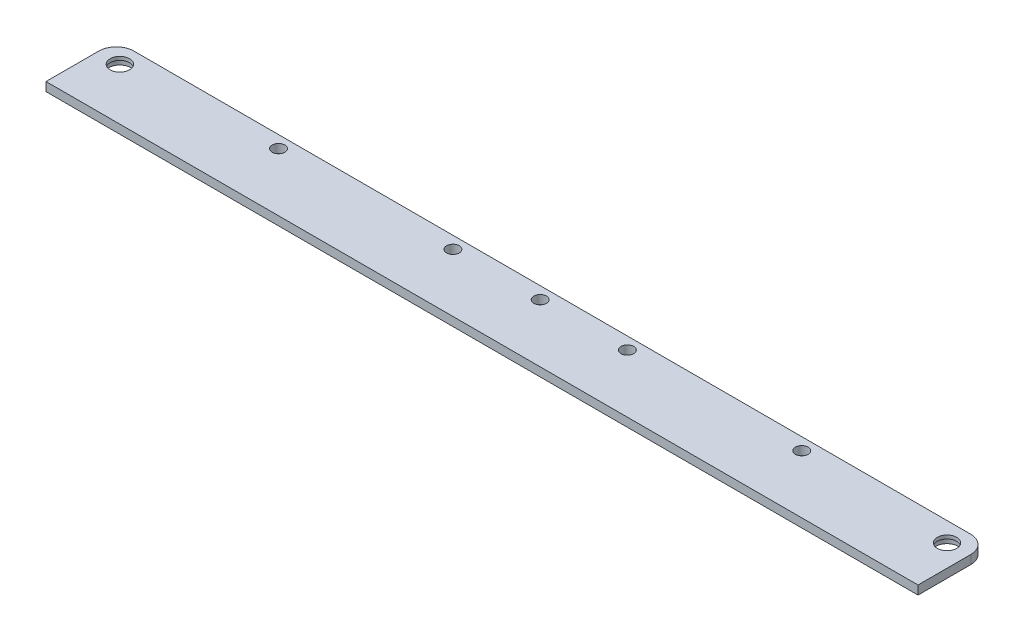
from build123d import *

# Parameters (mm, degrees)
SKETCH1_W           = 496
SKETCH1_H           = 40
SKETCH1_R           = 5.5
SKETCH1_R_2         = 3.6
BOSS_EXTRUDE1_DEPTH = 5
SKETCH2_R           = 6.5
CUT_EXTRUDE1_DEPTH  = 3
FILLET1_R           = 10


with BuildPart() as part:
    # Sketch1 → Boss-Extrude1 (new body)
    with BuildSketch(Plane(origin=(0, 0, 0), x_dir=(1, 0, 0), z_dir=(0, 1, 0))):
        with Locations((-144.299026304, 43.778006447)):
            Rectangle(SKETCH1_W, SKETCH1_H)
        with Locations(Location((-379.799026304, 53.278006447, 0), (0, 0, 270))):
            Circle(SKETCH1_R, mode=Mode.SUBTRACT)
        with Locations(Location((91.200973696, 52.778006447, 0), (0, 0, 270))):
            Circle(SKETCH1_R, mode=Mode.SUBTRACT)
        with Locations(Location((-293.099026304, 56.844673113, 0), (0, 0, 270))):
            Circle(SKETCH1_R_2, mode=Mode.SUBTRACT)
        with Locations(Location((-193.899026304, 56.844673113, 0), (0, 0, 270))):
            Circle(SKETCH1_R_2, mode=Mode.SUBTRACT)
        with Locations(Location((-94.699026304, 56.844673113, 0), (0, 0, 270))):
            Circle(SKETCH1_R_2, mode=Mode.SUBTRACT)
        with Locations(Location((4.500973696, 56.844673113, 0), (0, 0, 270))):
            Circle(SKETCH1_R_2, mode=Mode.SUBTRACT)
        with Locations(Location((-144.299026304, 56.844673113, 0), (0, 0, 270))):
            Circle(SKETCH1_R_2, mode=Mode.SUBTRACT)
    extrude(amount=BOSS_EXTRUDE1_DEPTH)

    # Sketch2 → Cut-Extrude1 (cut)
    with BuildSketch(Plane.XZ):
        with Locations(Location((-379.799026304, -53.278006447, 0), (0, 0, 270))):
            Circle(SKETCH2_R)
        with Locations(Location((91.200973696, -52.778006447, 0), (0, 0, 270))):
            Circle(SKETCH2_R)
    extrude(amount=-CUT_EXTRUDE1_DEPTH, mode=Mode.SUBTRACT)

    # Fillet1
    fillet1_edges = [part.edges().sort_by_distance(p)[0] for p in [
        (-392.299026304, 2.5, -63.778006447),
        (103.700973696, 2.5, -63.778006447),
    ]]
    fillet(fillet1_edges, radius=FILLET1_R)


solid = part.part
